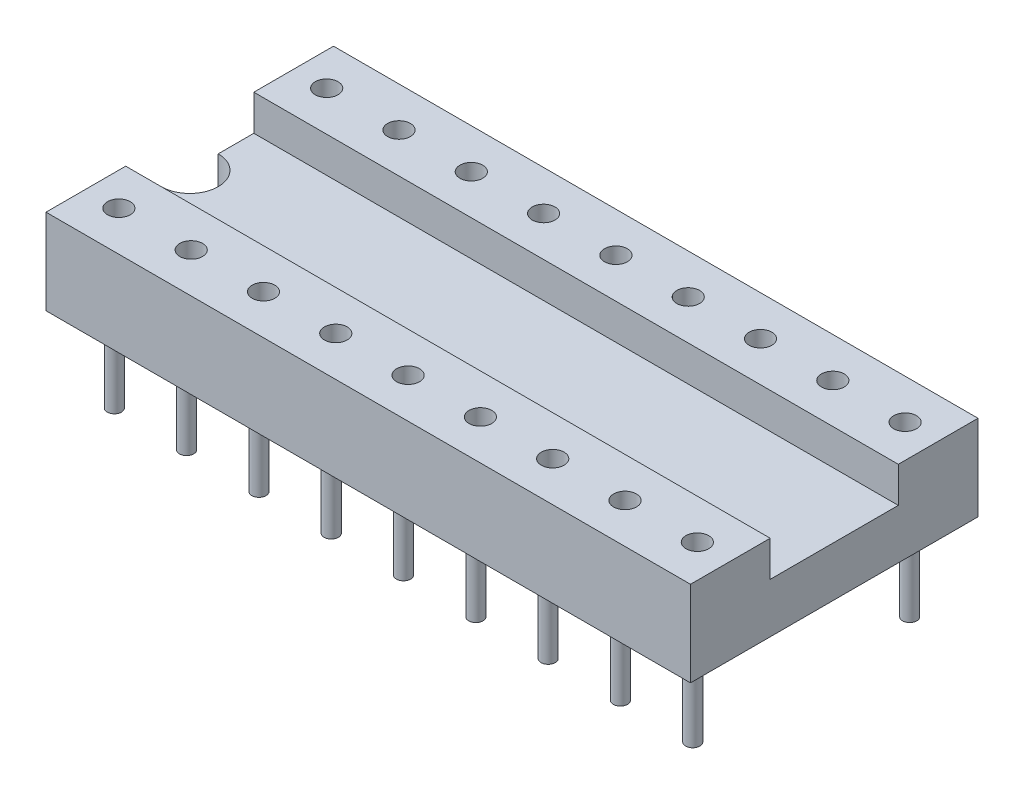
from build123d import *

# Parameters (mm, degrees)
EXTRUSION1_DEPTH        = 22.64
ENL_V_MAT_EXTRU_1_DEPTH = 24.262299972
ESQUISSE3_R             = 0.4
ENL_V_MAT_EXTRU_2_DEPTH = 2.5
ESQUISSE5_R             = 0.25
EXTRUSION2_DEPTH        = 3


with BuildPart() as part:
    # Esquisse1 → Extrusion1 (new body)
    with BuildSketch(Plane(origin=(0, 0, 0), x_dir=(0, 0, -1), z_dir=(1, 0, 0))):
        Polygon((-2.25, 1.75), (-2.25, 3), (-5.05, 3), (-5.05, 0), (5.05, 0), (5.05, 3), (2.25, 3), (2.25, 1.75), align=None)
    extrude(amount=EXTRUSION1_DEPTH)

    # Esquisse2 → Enlèv. mat.-Extru.1 (cut, through all)
    with BuildSketch(Plane(origin=(0, 1.75, 0), x_dir=(-1, 0, 0), z_dir=(0, 1, 0))):
        with BuildLine():
            Line((0, -1), (0, 1))
            ThreePointArc((0, 1), (-1, 0), (0, -1))
        make_face()
    extrude(amount=-ENL_V_MAT_EXTRU_1_DEPTH, mode=Mode.SUBTRACT)

    # Esquisse3 → Enlèv. mat.-Extru.2 (cut)
    with BuildSketch(Plane(origin=(0, 3, 0), x_dir=(-1, 0, 0), z_dir=(0, 1, 0))):
        with Locations(Location((-1.16, 3.65, 0), (0, 0, 90))):
            Circle(ESQUISSE3_R)
        with Locations(Location((-1.16, -3.65, 0), (0, 0, 270))):
            Circle(ESQUISSE3_R)
        with Locations(Location((-3.7, 3.65, 0), (0, 0, 90))):
            Circle(ESQUISSE3_R)
        with Locations(Location((-3.7, -3.65, 0), (0, 0, 270))):
            Circle(ESQUISSE3_R)
        with Locations(Location((-6.24, 3.65, 0), (0, 0, 90))):
            Circle(ESQUISSE3_R)
        with Locations(Location((-6.24, -3.65, 0), (0, 0, 270))):
            Circle(ESQUISSE3_R)
        with Locations(Location((-8.78, 3.65, 0), (0, 0, 90))):
            Circle(ESQUISSE3_R)
        with Locations(Location((-8.78, -3.65, 0), (0, 0, 270))):
            Circle(ESQUISSE3_R)
        with Locations(Location((-11.32, 3.65, 0), (0, 0, 90))):
            Circle(ESQUISSE3_R)
        with Locations(Location((-11.32, -3.65, 0), (0, 0, 270))):
            Circle(ESQUISSE3_R)
        with Locations(Location((-13.86, 3.65, 0), (0, 0, 90))):
            Circle(ESQUISSE3_R)
        with Locations(Location((-13.86, -3.65, 0), (0, 0, 270))):
            Circle(ESQUISSE3_R)
        with Locations(Location((-16.4, 3.65, 0), (0, 0, 90))):
            Circle(ESQUISSE3_R)
        with Locations(Location((-16.4, -3.65, 0), (0, 0, 270))):
            Circle(ESQUISSE3_R)
        with Locations(Location((-18.94, 3.65, 0), (0, 0, 90))):
            Circle(ESQUISSE3_R)
        with Locations(Location((-18.94, -3.65, 0), (0, 0, 270))):
            Circle(ESQUISSE3_R)
        with Locations(Location((-21.48, 3.65, 0), (0, 0, 90))):
            Circle(ESQUISSE3_R)
        with Locations(Location((-21.48, -3.65, 0), (0, 0, 270))):
            Circle(ESQUISSE3_R)
    extrude(amount=-ENL_V_MAT_EXTRU_2_DEPTH, mode=Mode.SUBTRACT)

    # Esquisse5 → Extrusion2 (add)
    with BuildSketch(Plane.XZ):
        with Locations(Location((1.16, 3.81, 0), (0, 0, 90))):
            Circle(ESQUISSE5_R)
        with Locations(Location((1.16, -3.81, 0), (0, 0, 90))):
            Circle(ESQUISSE5_R)
        with Locations(Location((3.7, -3.81, 0), (0, 0, 90))):
            Circle(ESQUISSE5_R)
        with Locations(Location((3.7, 3.81, 0), (0, 0, 90))):
            Circle(ESQUISSE5_R)
        with Locations(Location((6.24, -3.81, 0), (0, 0, 90))):
            Circle(ESQUISSE5_R)
        with Locations(Location((6.24, 3.81, 0), (0, 0, 90))):
            Circle(ESQUISSE5_R)
        with Locations(Location((8.78, -3.81, 0), (0, 0, 90))):
            Circle(ESQUISSE5_R)
        with Locations(Location((8.78, 3.81, 0), (0, 0, 90))):
            Circle(ESQUISSE5_R)
        with Locations(Location((11.32, -3.81, 0), (0, 0, 90))):
            Circle(ESQUISSE5_R)
        with Locations(Location((11.32, 3.81, 0), (0, 0, 90))):
            Circle(ESQUISSE5_R)
        with Locations(Location((13.86, -3.81, 0), (0, 0, 90))):
            Circle(ESQUISSE5_R)
        with Locations(Location((13.86, 3.81, 0), (0, 0, 90))):
            Circle(ESQUISSE5_R)
        with Locations(Location((16.4, -3.81, 0), (0, 0, 90))):
            Circle(ESQUISSE5_R)
        with Locations(Location((16.4, 3.81, 0), (0, 0, 90))):
            Circle(ESQUISSE5_R)
        with Locations(Location((18.94, -3.81, 0), (0, 0, 90))):
            Circle(ESQUISSE5_R)
        with Locations(Location((18.94, 3.81, 0), (0, 0, 90))):
            Circle(ESQUISSE5_R)
        with Locations(Location((21.48, -3.81, 0), (0, 0, 90))):
            Circle(ESQUISSE5_R)
        with Locations(Location((21.48, 3.81, 0), (0, 0, 90))):
            Circle(ESQUISSE5_R)
    extrude(amount=EXTRUSION2_DEPTH)


solid = part.part
